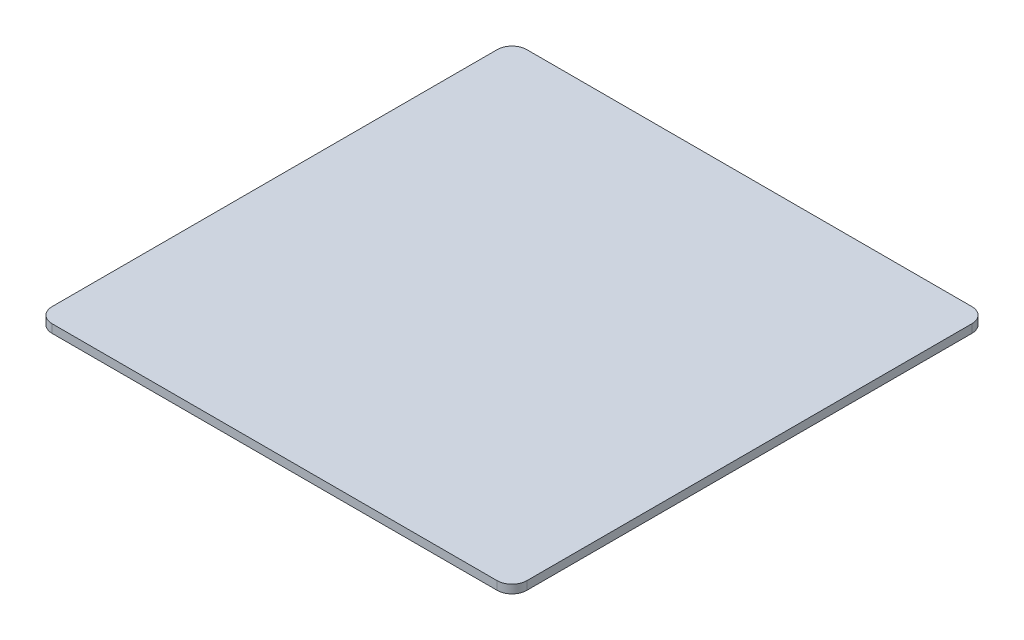
from build123d import *

# Parameters (mm, degrees)
SKETCH1_W           = 96
SKETCH1_H           = 96
BOSS_EXTRUDE1_DEPTH = 1.7
FILLET1_R           = 3


with BuildPart() as part:
    # Sketch1 → Boss-Extrude1 (new body)
    with BuildSketch(Plane(origin=(0, 0, 0), x_dir=(1, 0, 0), z_dir=(0, 1, 0))):
        Rectangle(SKETCH1_W, SKETCH1_H)
    extrude(amount=BOSS_EXTRUDE1_DEPTH)

    # Fillet1
    fillet1_edges = [part.edges().sort_by_distance(p)[0] for p in [
        (-48, 0.85, -48),
        (48, 0.85, -48),
        (48, 0.85, 48),
        (-48, 0.85, 48),
    ]]
    fillet(fillet1_edges, radius=FILLET1_R)


solid = part.part
